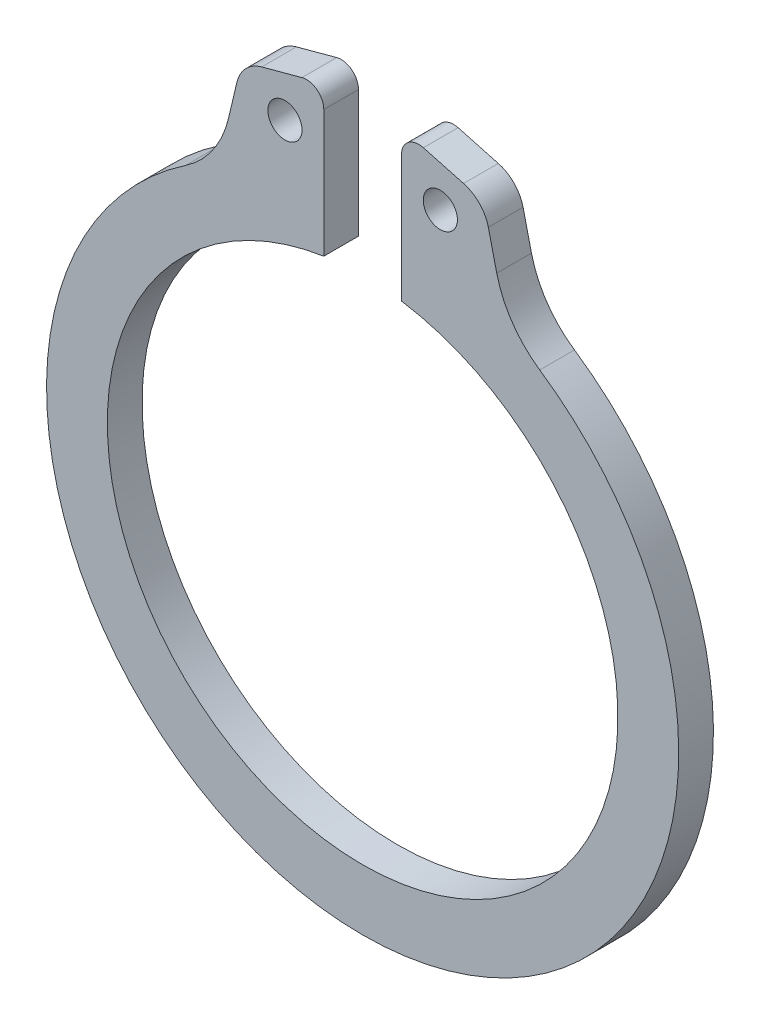
from build123d import *

# Parameters (mm, degrees)
SKETCH_1_R      = 0.491728838
EXTRUDE_1_DEPTH = 1


with BuildPart() as part:
    # 草图1 → 凸台-拉伸1 (new body)
    with BuildSketch(Plane.XY):
        with BuildLine():
            Line((1.748834408, 11.402867185), (2.236845371, 11.271018751))
            Line((2.236845371, 11.271018751), (2.906504263, 11.090093561))
            ThreePointArc((2.906504263, 11.090093561), (3.363858628, 10.820566678), (3.618817735, 10.354934194))
            Line((3.618817735, 10.354934194), (3.861047435, 9.33106424))
            ThreePointArc((3.861047435, 9.33106424), (4.311482707, 8.317586053), (5.09935285, 7.537015358))
            ThreePointArc((5.09935285, 7.537015358), (0, -9.1), (-5.09935285, 7.537015358))
            ThreePointArc((-5.09935285, 7.537015358), (-4.311482707, 8.317586053), (-3.861047435, 9.33106424))
            Line((-3.861047435, 9.33106424), (-3.618817735, 10.354934194))
            ThreePointArc((-3.618817735, 10.354934194), (-3.363858628, 10.820566678), (-2.906504263, 11.090093561))
            Line((-2.906504263, 11.090093561), (-2.236845371, 11.271018751))
            Line((-2.236845371, 11.271018751), (-1.748834408, 11.402867185))
            ThreePointArc((-1.748834408, 11.402867185), (-1.314453823, 11.317166281), (-1.118422685, 10.920173925))
            Line((-1.118422685, 10.920173925), (-1.118422685, 9.031009395))
            Line((-1.118422685, 9.031009395), (-1.118422685, 7.264408489))
            ThreePointArc((-1.118422685, 7.264408489), (0, -7.35), (1.118422685, 7.264408489))
            Line((1.118422685, 7.264408489), (1.118422685, 9.031009395))
            Line((1.118422685, 9.031009395), (1.118422685, 10.920173925))
            ThreePointArc((1.118422685, 10.920173925), (1.314453823, 11.317166281), (1.748834408, 11.402867185))
        make_face()
        with Locations((2.236845371, 10.095934401)):
            Circle(SKETCH_1_R, mode=Mode.SUBTRACT)
        with Locations(Location((-2.236845371, 10.095934401, 0), (0, 0, 180))):
            Circle(SKETCH_1_R, mode=Mode.SUBTRACT)
    extrude(amount=EXTRUDE_1_DEPTH)


solid = part.part
